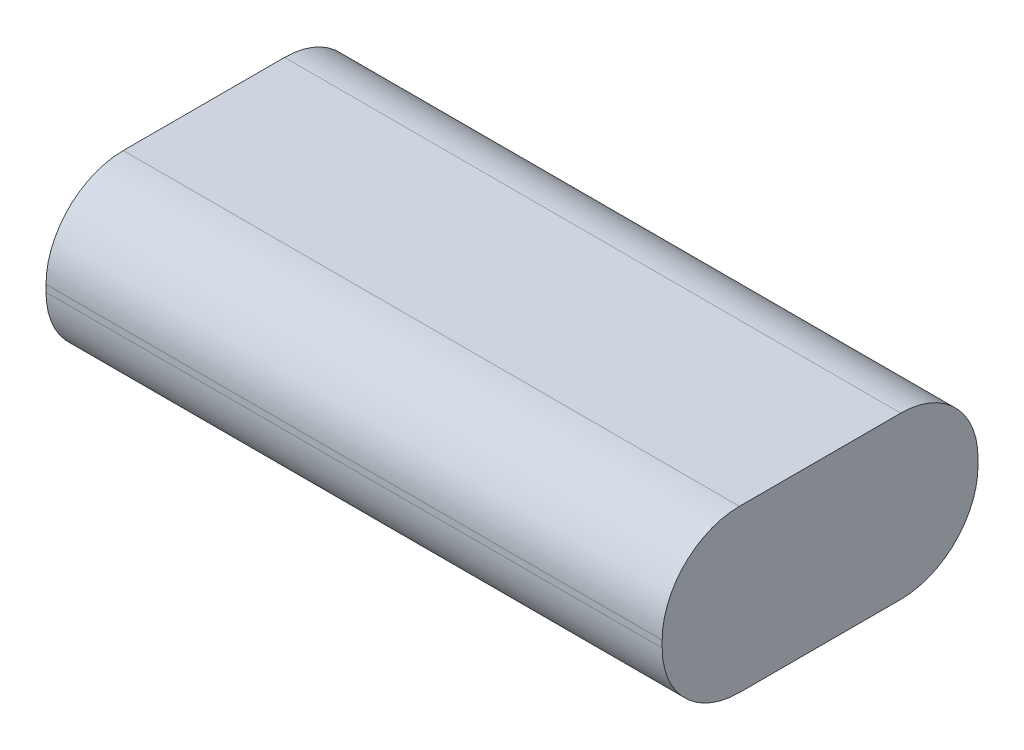
from build123d import *

# Parameters (mm, degrees)
SKETCH1_W           = 71.8
SKETCH1_H           = 36.8
BOSS_EXTRUDE1_DEPTH = 18.8
FILLET1_R           = 9


with BuildPart() as part:
    # Sketch1 → Boss-Extrude1 (new body)
    with BuildSketch(Plane(origin=(0, 0, 0), x_dir=(1, 0, 0), z_dir=(0, 1, 0))):
        with Locations((35.9, 18.4)):
            Rectangle(SKETCH1_W, SKETCH1_H)
    extrude(amount=BOSS_EXTRUDE1_DEPTH)

    # Fillet1
    fillet1_edges = [part.edges().sort_by_distance(p)[0] for p in [
        (35.9, 18.8, -36.8),
        (35.9, 0, -36.8),
        (35.9, 0, 0),
        (35.9, 18.8, 0),
    ]]
    fillet(fillet1_edges, radius=FILLET1_R)


solid = part.part
